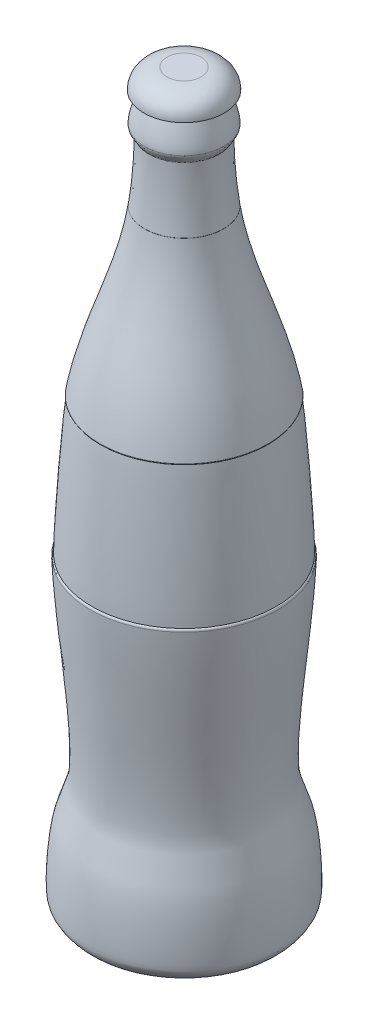
from build123d import *

# Parameters (mm, degrees)
ESBO_O4_R             = 0.5
CORTE_EXTRUS_O3_DEPTH = 0.4
ESBO_O5_R             = 12.161962761
CORTE_EXTRUS_O4_DEPTH = 0.01


with BuildPart() as part:
    # Esboço3 → Revolução4 (revolve)
    with BuildSketch(Plane.XY):
        with BuildLine():
            Line((68.409468023, 78.588337077), (70.2369282, 78.588337077))
            Line((70.2369282, 78.588337077), (70.2369282, 0.72855248))
            Line((70.2369282, 0.72855248), (61.717431433, 0.72855248))
            add(Edge.make_bspline(
                [(61.717431433, 0.72855248), (60.751546913, 0.72855248), (60.110434586, 1.627093944), (59.737836639, 2.470376304), (59.889729494, 8.940650688), (61.516542034, 11.99497249), (61.796939403, 19.044366899), (60.5449633, 26.368535965), (60.232078383, 33.378991449)],
                knots=[0, 0, 0, 0, 0.208168804, 0.249427649, 0.412588444, 0.515443912, 0.574185068, 1, 1, 1, 1], degree=3))
            add(Edge.make_bspline(
                [(60.37137552, 33.628265179), (60.269389159, 33.590747067), (60.233662178, 33.493952324), (60.232078383, 33.378991449)],
                knots=[0, 0, 0, 0, 1, 1, 1, 1], degree=3))
            add(Edge.make_bspline(
                [(61.334000106, 48.095720085), (61.00433264, 45.496831909), (60.421168392, 37.103324909), (60.37137552, 33.628265179)],
                knots=[0, 0, 0, 0, 1, 1, 1, 1], degree=3))
            add(Edge.make_bspline(
                [(61.257241657, 48.231375414), (61.249068488, 48.186491522), (61.284732543, 48.122194108), (61.334000106, 48.095720085)],
                knots=[0, 0, 0, 0, 1, 1, 1, 1], degree=3))
            add(Edge.make_bspline(
                [(66.476371283, 72.402019137), (66.476371283, 69.970680002), (66.159035293, 65.683827945), (64.159474385, 57.253453832), (62.247816689, 53.671231348), (61.257241657, 48.231375414)],
                knots=[0, 0, 0, 0, 0.259252546, 0.359252546, 1, 1, 1, 1], degree=3))
            add(Edge.make_bspline(
                [(65.999647343, 73.37030672), (65.999647343, 73.059092303), (66.476371283, 72.529263326), (66.476371283, 72.402019137)],
                knots=[0, 0, 0, 0, 1, 1, 1, 1], degree=3))
            add(Edge.make_bspline(
                [(65.999647343, 73.37030672), (65.999647343, 74.197074379), (66.839482035, 76.471404644)],
                knots=[0, 0, 0, 1, 1, 1], degree=2))
            Line((66.839482035, 76.471404644), (65.949262934, 76.471404644))
            add(Edge.make_bspline(
                [(68.409468023, 78.588337077), (67.155283918, 78.588337077), (65.949262934, 77.851984406), (65.949262934, 76.471404644)],
                knots=[0, 0, 0, 0, 1, 1, 1, 1], degree=3))
        make_face()
    revolve(axis=Axis((70.2369282, 0.72855248, 0), (0, 1, 0)))

    # Esboço4 → Corte-extrusão3 (cut)
    with BuildSketch(Plane.XZ.offset(-0.72855248)):
        with Locations(Location((70.2369282, 0, 0), (0, 0, 270))):
            Circle(ESBO_O4_R)
    extrude(amount=-CORTE_EXTRUS_O3_DEPTH, mode=Mode.SUBTRACT)

    # Esboço5 → Corte-extrusão4 (cut)
    with BuildSketch(Plane(origin=(0, 65.72855248, 0), x_dir=(-1, 0, 0), z_dir=(0, -1, 0))):
        with Locations((-70.2369282, 0)):
            Circle(ESBO_O5_R)
    extrude(amount=-CORTE_EXTRUS_O4_DEPTH, mode=Mode.SUBTRACT)


with BuildPart() as corte_extrus_o4_piece_1:
    # of the separate pieces the step leaves, piece 1, a body of its own (corte_extrus_o4_pieces)
    add(part.part.solids().sort_by_distance((66.014049488, 65.72855248, 0))[0])


with BuildPart() as corte_extrus_o4_piece_2:
    # of the separate pieces the step leaves, piece 2, a body of its own (corte_extrus_o4_pieces)
    add(part.part.solids().sort_by_distance((68.409468023, 78.588337077, 0))[0])


solid = Compound([corte_extrus_o4_piece_1.part, corte_extrus_o4_piece_2.part])
